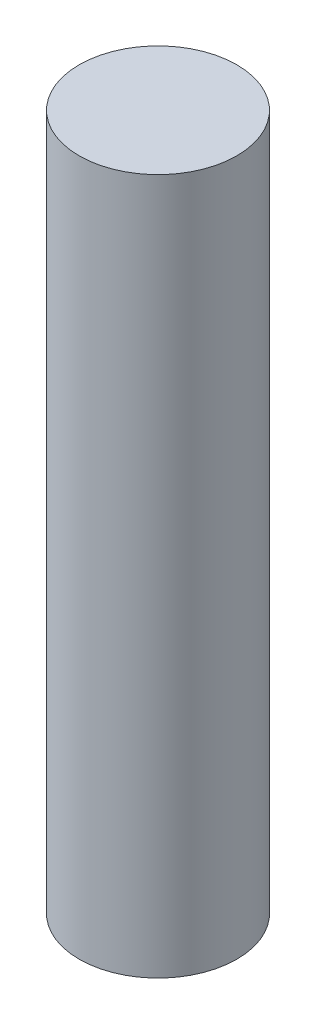
from build123d import *

# Parameters (mm, degrees)
SKETCH1_R           = 3.4
BOSS_EXTRUDE1_DEPTH = 30


with BuildPart() as part:
    # Sketch1 → Boss-Extrude1 (new body)
    with BuildSketch(Plane(origin=(0, 0, 0), x_dir=(1, 0, 0), z_dir=(0, 1, 0))):
        with Locations(Location((0, 0, 0), (0, 0, 270))):
            Circle(SKETCH1_R)
    extrude(amount=BOSS_EXTRUDE1_DEPTH)


solid = part.part
